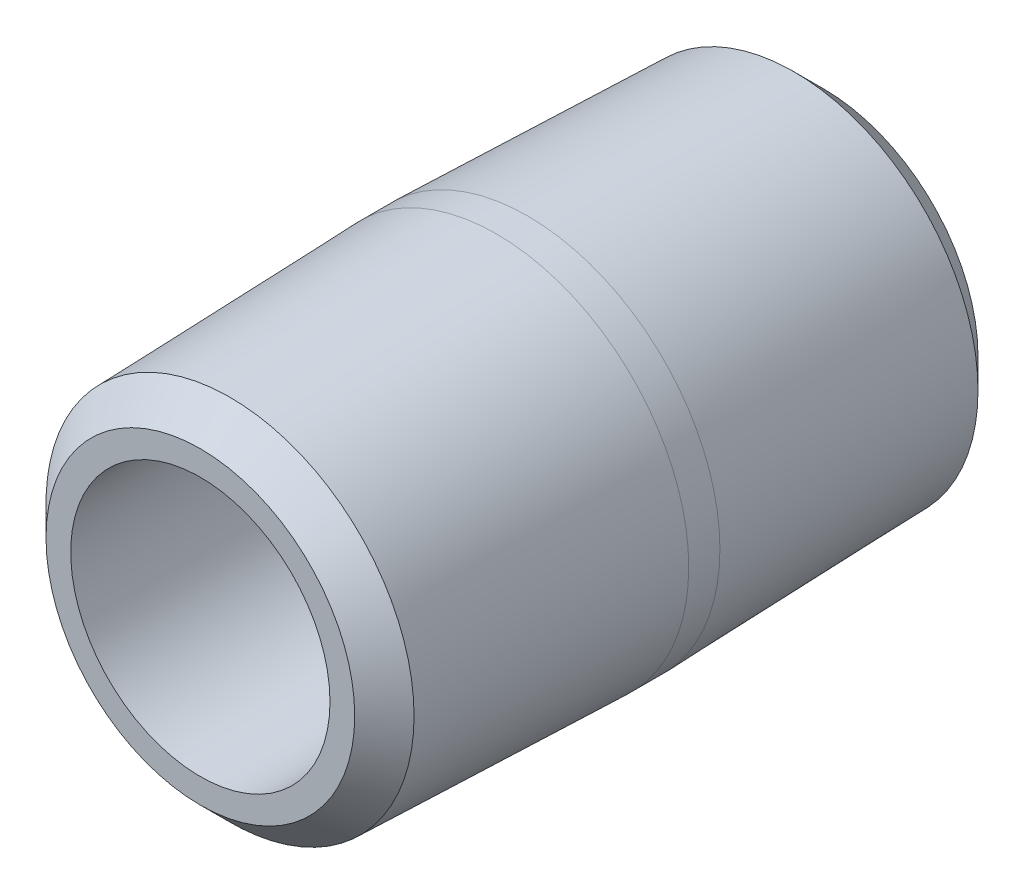
from build123d import *


with BuildPart() as part:
    # Sketch1 → Revolve1 (revolve)
    with BuildSketch(Plane(origin=(0, 0, 0), x_dir=(0, 0, -1), z_dir=(1, 0, 0))):
        Polygon((-11.1125, 4.6228), (-11.1125, 5.503928687), (-10.054166667, 6.56226202), (-0.555625, 6.858), (0.555625, 6.858), (10.054166667, 6.56226202), (11.1125, 5.503928687), (11.1125, 4.6228), align=None)
    revolve(axis=Axis((0, 0, 11.1125), (0, 0, -1)))


solid = part.part
